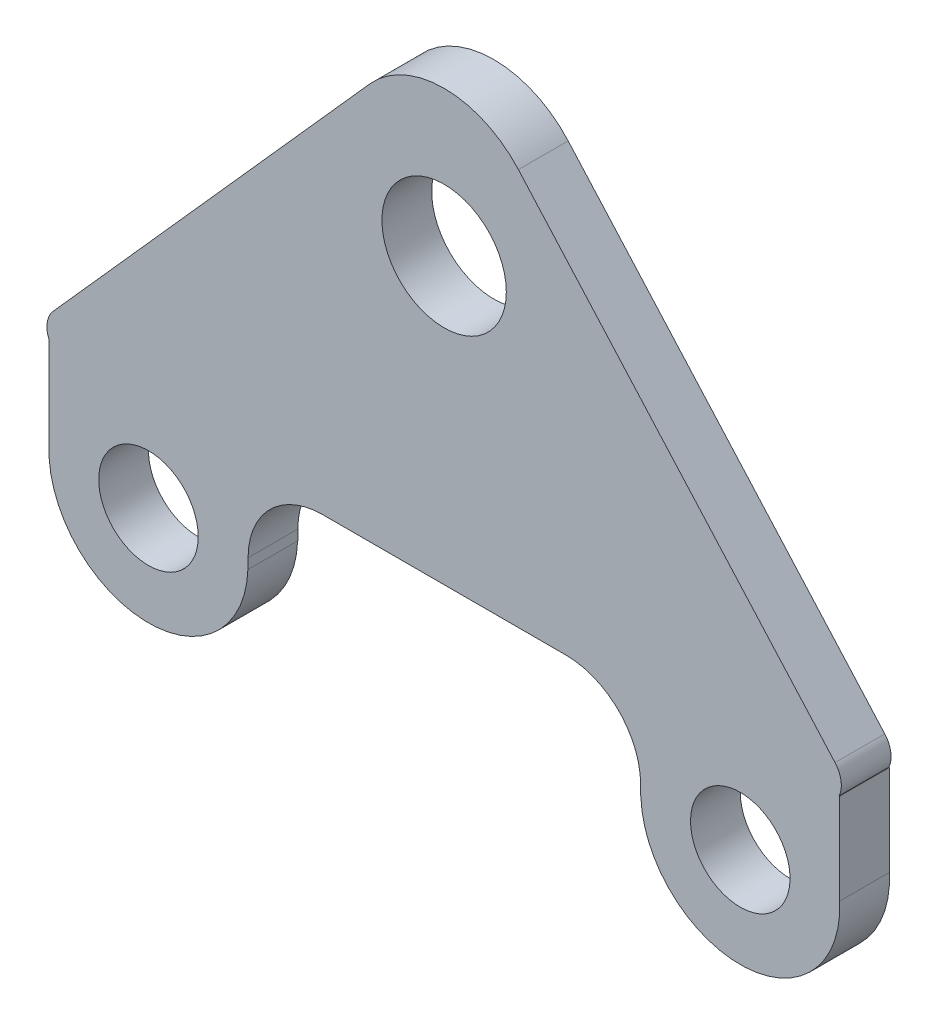
from build123d import *

# Parameters (mm, degrees)
BOSS_EXTRUDE1_DEPTH  = 4
FILLET1_R            = 8
FILLET2_R            = 2
SKETCH8_R            = 5
CUT_EXTRUDE1_DEPTH   = 4
SKETCH3_W            = 16
SKETCH3_H            = 8
BOSS_EXTRUDE2_DEPTH  = 4
SKETCH10_R           = 8
BOSS_EXTRUDE3_DEPTH  = 4
FILLET3_R            = 6
SKETCH11_R           = 4
CUT_EXTRUDE2_DEPTH   = 4
FILLET3_OF_MIRROR1_R = 6


with BuildPart() as part:
    # Sketch2 → Boss-Extrude1 (new body)
    with BuildSketch(Plane.XY):
        Polygon((-24.718317205, 0), (44.079761222, 0), (9.680722008, 38.594041061), align=None)
    extrude(amount=BOSS_EXTRUDE1_DEPTH)

    # Fillet1
    fillet1_edges = [part.edges().sort_by_distance(p)[0] for p in [
        (9.680722008, 38.594041061, 2),
    ]]
    fillet(fillet1_edges, radius=FILLET1_R)

    # Fillet2
    fillet2_edges = [part.edges().sort_by_distance(p)[0] for p in [
        (44.079761222, 0, 2),
        (-24.718317205, 0, 2),
    ]]
    fillet(fillet2_edges, radius=FILLET2_R)

    # Sketch8 → Cut-Extrude1 (cut)
    with BuildSketch(Plane.XY.offset(4)):
        with Locations((9.680722008, 22.887439188)):
            Circle(SKETCH8_R)
    extrude(amount=-CUT_EXTRUDE1_DEPTH, mode=Mode.SUBTRACT)

    # Sketch3 → Boss-Extrude2 (add)
    with BuildSketch(Plane.XY):
        with Locations((-14.081618267, -2.818082449)):
            Rectangle(SKETCH3_W, SKETCH3_H)
    boss_extrude2 = extrude(amount=BOSS_EXTRUDE2_DEPTH)

    # Sketch10 → Boss-Extrude3 (add)
    with BuildSketch(Plane.XY.offset(4)):
        with Locations((-14.092338513, -6.548407243)):
            Circle(SKETCH10_R)
    boss_extrude3 = extrude(amount=-BOSS_EXTRUDE3_DEPTH)

    # Fillet3
    fillet3_edges = [part.edges().sort_by_distance(p)[0] for p in [
        (-6.081618267, 0, 2),
    ]]
    fillet(fillet3_edges, radius=FILLET3_R)

    # Sketch11 → Cut-Extrude2 (cut)
    with BuildSketch(Plane.XY.offset(4)):
        with Locations((-14.092338513, -6.548407243)):
            Circle(SKETCH11_R)
    cut_extrude2 = extrude(amount=-CUT_EXTRUDE2_DEPTH, mode=Mode.SUBTRACT)

    # Mirror1: Boss-Extrude2, Boss-Extrude3, Cut-Extrude2 across plane
    add(boss_extrude2.mirror(Plane(origin=(9.7, 0, 0), x_dir=(0, 0, 1), z_dir=(1, 0, 0))))
    add(boss_extrude3.mirror(Plane(origin=(9.7, 0, 0), x_dir=(0, 0, 1), z_dir=(1, 0, 0))))
    add(cut_extrude2.mirror(Plane(origin=(9.7, 0, 0), x_dir=(0, 0, 1), z_dir=(1, 0, 0))), mode=Mode.SUBTRACT)

    # Fillet3 of Mirror1
    fillet3_of_mirror1_edges = [part.edges().sort_by_distance(p)[0] for p in [
        (25.481618267, 0, 2),
    ]]
    fillet(fillet3_of_mirror1_edges, radius=FILLET3_OF_MIRROR1_R)


solid = part.part
